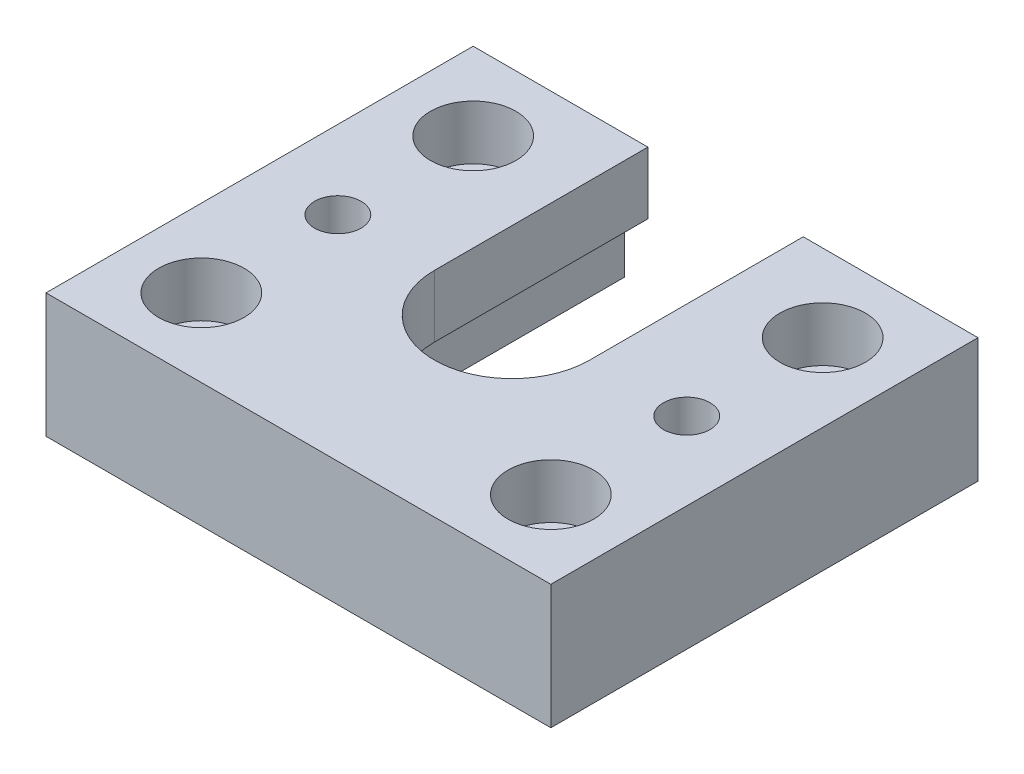
from build123d import *

# Parameters (mm, degrees)
SKETCH1_W                                            = 65
SKETCH1_H                                            = 55
BOSS_EXTRUDE1_DEPTH                                  = 16
CBORE_SLOT_FOR_M6_HEX_SOCKET_HEAD_CAP_SC_D           = 6.6
CBORE_SLOT_FOR_M6_HEX_SOCKET_HEAD_CAP_SC_CBORE_D     = 11
CBORE_SLOT_FOR_M6_HEX_SOCKET_HEAD_CAP_SC_CBORE_DEPTH = 7
F_6_0MM_DOWEL_HOLE1_D                                = 6
SKETCH23_R                                           = 13
CUT_EXTRUDE2_DEPTH                                   = 8
SKETCH24_R                                           = 10
CUT_EXTRUDE3_DEPTH                                   = 86.521927013


with BuildPart() as part:
    # Sketch1 → Boss-Extrude1 (new body)
    with BuildSketch(Plane(origin=(0, 0, 0), x_dir=(1, 0, 0), z_dir=(0, 1, 0))):
        with Locations((32.5, 27.5)):
            Rectangle(SKETCH1_W, SKETCH1_H)
    extrude(amount=BOSS_EXTRUDE1_DEPTH)

    # CBORE SLOT for M6 Hex Socket Head Cap Screw1 (through all)
    with Locations(Plane(origin=(0, 16, 0), x_dir=(1, 0, 0), z_dir=(0, 1, 0))):
        with Locations((10, 45), (55, 45), (55, 10), (10, 10)):
            CounterBoreHole(CBORE_SLOT_FOR_M6_HEX_SOCKET_HEAD_CAP_SC_D / 2, CBORE_SLOT_FOR_M6_HEX_SOCKET_HEAD_CAP_SC_CBORE_D / 2, CBORE_SLOT_FOR_M6_HEX_SOCKET_HEAD_CAP_SC_CBORE_DEPTH)

    # Ø6.0mm Dowel Hole1 (through all)
    with Locations(Plane(origin=(0, 16, 0), x_dir=(1, 0, 0), z_dir=(0, 1, 0))):
        with Locations((10.078116325, 27.5), (55, 27.5)):
            Hole(F_6_0MM_DOWEL_HOLE1_D / 2)

    # Sketch23 → Cut-Extrude2 (cut)
    with BuildSketch(Plane.XZ):
        with BuildLine():
            ThreePointArc((45.5, -27.5), (32.5, -40.5), (19.5, -27.5))
            Line((19.5, -27.5), (19.5, -55))
            Line((19.5, -55), (45.5, -55))
            Line((45.5, -55), (45.5, -27.5))
        make_face()
        with Locations((32.5, -27.5)):
            Circle(SKETCH23_R)
    extrude(amount=-CUT_EXTRUDE2_DEPTH, mode=Mode.SUBTRACT)

    # Sketch24 → Cut-Extrude3 (cut, through all)
    with BuildSketch(Plane.XZ.offset(-8)):
        with Locations((32.5, -27.5)):
            Circle(SKETCH24_R)
        with BuildLine():
            Line((42.5, -55), (42.5, -27.5))
            ThreePointArc((42.5, -27.5), (32.5, -37.5), (22.5, -27.5))
            Line((22.5, -27.5), (22.5, -55))
            Line((22.5, -55), (42.5, -55))
        make_face()
    extrude(amount=-CUT_EXTRUDE3_DEPTH, mode=Mode.SUBTRACT)


solid = part.part
